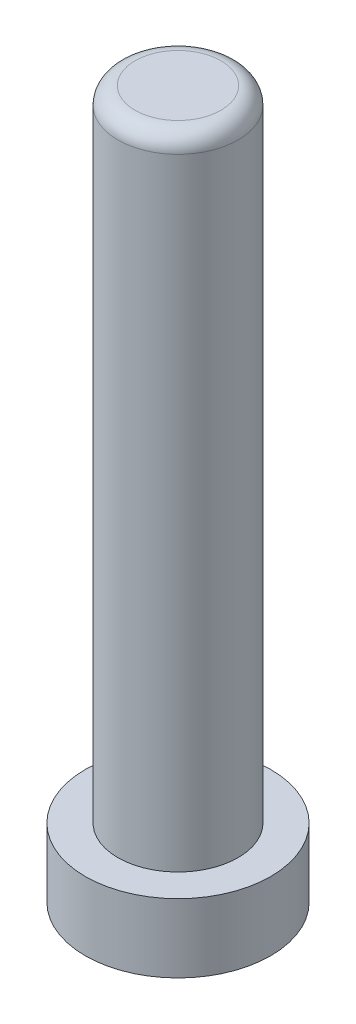
from build123d import *

# Parameters (mm, degrees)
SKETCH1_R           = 2.7
BOSS_EXTRUDE1_DEPTH = 2
SKETCH3_R           = 0.95
CUT_EXTRUDE2_DEPTH  = 9.5
SKETCH2_R           = 1.75
BOSS_EXTRUDE2_DEPTH = 18.6
SKETCH7_R           = 1.2
CUT_EXTRUDE4_DEPTH  = 2.8
FILLET2_R           = 0.5
SKETCH8_R           = 0.85
CUT_EXTRUDE5_DEPTH  = 10.5


with BuildPart() as part:
    # Sketch1 → Boss-Extrude1 (new body)
    with BuildSketch(Plane(origin=(0, 0, 0), x_dir=(1, 0, 0), z_dir=(0, 1, 0))):
        with Locations(Location((0, 0, 0), (0, 0, 270))):
            Circle(SKETCH1_R)
    extrude(amount=BOSS_EXTRUDE1_DEPTH)

    # Sketch3 → Cut-Extrude2 (cut)
    with BuildSketch(Plane.XZ):
        with Locations(Location((0, 0, 0), (0, 0, 270))):
            Circle(SKETCH3_R)
    extrude(amount=-CUT_EXTRUDE2_DEPTH, mode=Mode.SUBTRACT)

    # Sketch2 → Boss-Extrude2 (add)
    with BuildSketch(Plane(origin=(0, 2, 0), x_dir=(1, 0, 0), z_dir=(0, 1, 0))):
        with Locations(Location((0, 0, 0), (0, 0, 270))):
            Circle(SKETCH2_R)
    extrude(amount=BOSS_EXTRUDE2_DEPTH)

    # Sketch7 → Cut-Extrude4 (cut)
    with BuildSketch(Plane.XZ):
        with Locations(Location((0, 0, 0), (0, 0, 270))):
            Circle(SKETCH7_R)
    extrude(amount=-CUT_EXTRUDE4_DEPTH, mode=Mode.SUBTRACT)

    # Fillet2
    fillet2_edges = [part.edges().sort_by_distance(p)[0] for p in [
        (0, 20.6, -1.75),
    ]]
    fillet(fillet2_edges, radius=FILLET2_R)

    # Sketch8 → Cut-Extrude5 (cut)
    with BuildSketch(Plane.XZ):
        with Locations(Location((0, 0, 0), (0, 0, 270))):
            Circle(SKETCH8_R)
    extrude(amount=-CUT_EXTRUDE5_DEPTH, mode=Mode.SUBTRACT)


solid = part.part
